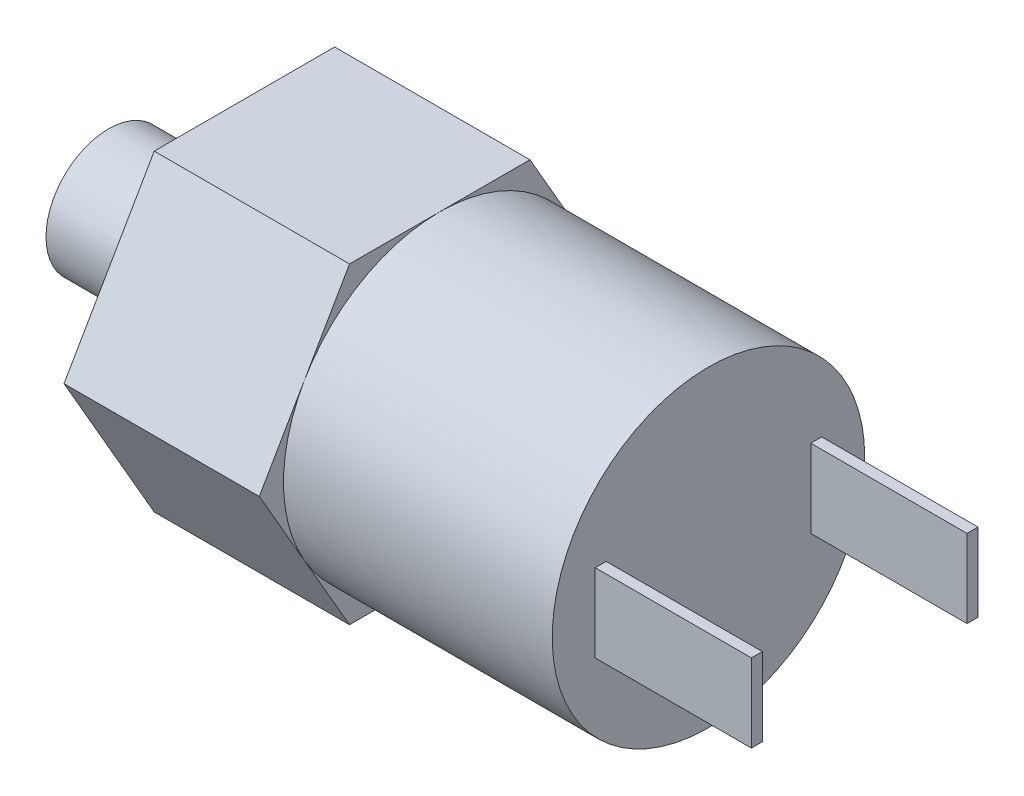
from build123d import *

# Parameters (mm, degrees)
BOSS_EXTRUDE1_DEPTH = 15.875
SKETCH2_R           = 12.7
BOSS_EXTRUDE2_DEPTH = 21.844
SKETCH3_R           = 5.08
BOSS_EXTRUDE3_DEPTH = 11.049
FILLET1_R           = 1.905
SKETCH4_W           = 0.889
SKETCH4_H           = 6.35
BOSS_EXTRUDE4_DEPTH = 12.7


with BuildPart() as part:
    # Sketch1 → Boss-Extrude1 (new body)
    with BuildSketch(Plane(origin=(0, 0, 0), x_dir=(0, 0, -1), z_dir=(1, 0, 0))):
        Polygon((14.664696837, 0), (7.332348419, 12.7), (-7.332348419, 12.7), (-14.664696837, 0), (-7.332348419, -12.7), (7.332348419, -12.7), align=None)
    extrude(amount=BOSS_EXTRUDE1_DEPTH)

    # Sketch2 → Boss-Extrude2 (add)
    with BuildSketch(Plane(origin=(15.875, 0, 0), x_dir=(0, 0, -1), z_dir=(1, 0, 0))):
        with Locations(Location((0, 0, 0), (0, 0, 150))):
            Circle(SKETCH2_R)
    extrude(amount=BOSS_EXTRUDE2_DEPTH)

    # Sketch3 → Boss-Extrude3 (add)
    with BuildSketch(Plane.ZY):
        with Locations(Location((0, 0, 0), (0, 0, 180))):
            Circle(SKETCH3_R)
    extrude(amount=BOSS_EXTRUDE3_DEPTH)

    # Fillet1
    fillet1_edges = [part.edges().sort_by_distance(p)[0] for p in [
        (0, 0, 5.08),
    ]]
    fillet(fillet1_edges, radius=FILLET1_R)

    # Sketch4 → Boss-Extrude4 (add)
    with BuildSketch(Plane(origin=(37.719, 0, 0), x_dir=(0, 0, -1), z_dir=(1, 0, 0))):
        with Locations((-8.763, 0)):
            Rectangle(SKETCH4_W, SKETCH4_H)
        with Locations((8.763, 0)):
            Rectangle(SKETCH4_W, SKETCH4_H)
    extrude(amount=BOSS_EXTRUDE4_DEPTH)


solid = part.part
